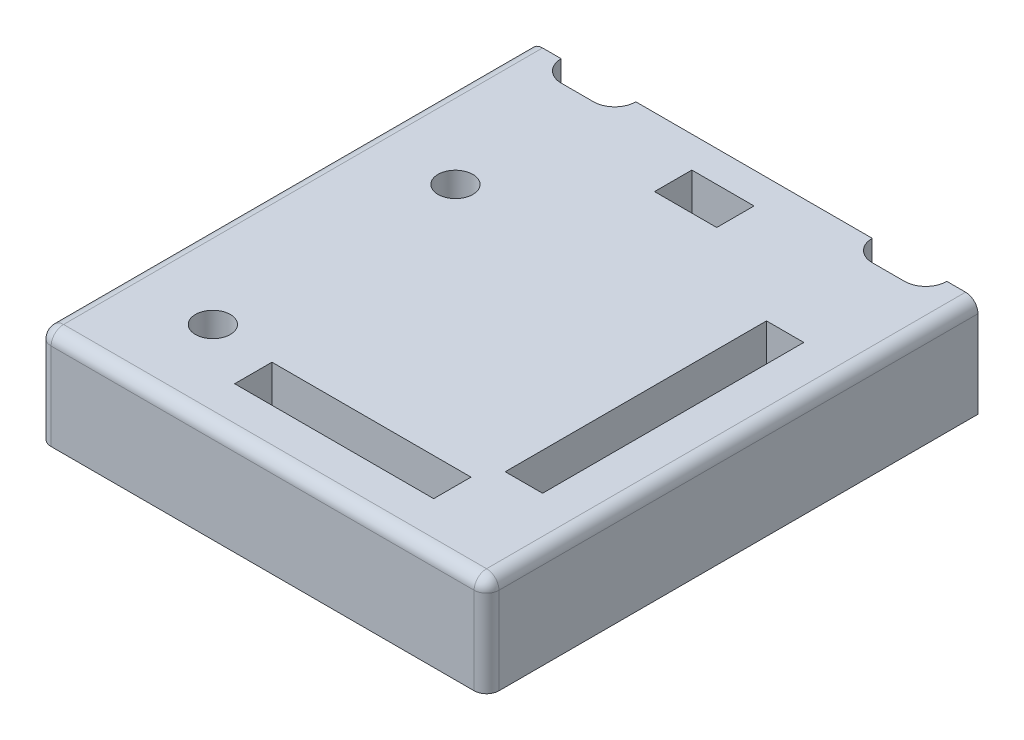
from build123d import *

# Parameters (mm, degrees)
SKETCH1_W                         = 36
SKETCH1_H                         = 33.5
SKETCH1_R                         = 1.4
SKETCH1_W_2                       = 3
SKETCH1_H_2                       = 21
SKETCH1_W_3                       = 16
SKETCH1_H_3                       = 3
BASE_DEPTH                        = 8
SKETCH3_W                         = 31
SKETCH3_H                         = 28.5
INTERIOR_CUTOUT_DEPTH             = 5
BASKET_MOUNTING_EDGE_DEPTH        = 8
SKETCH6_R                         = 1.4
BASKET_MOUNTING_SCREW_HOLES_DEPTH = 7
SKETCH7_W                         = 5
SKETCH7_H                         = 3
ZIP_TIE_HOLE_DEPTH                = 31.092565527
F_1MM_EDGE_FILLETS_R              = 1


with BuildPart() as part:
    # Sketch1 → Base (new body)
    with BuildSketch(Plane(origin=(0, 0, 0), x_dir=(1, 0, 0), z_dir=(0, 1, 0))):
        Rectangle(SKETCH1_W, SKETCH1_H)
        with Locations(Location((-11, -9.75, 0), (0, 0, 270))):
            Circle(SKETCH1_R, mode=Mode.SUBTRACT)
        with Locations(Location((-11, 9.75, 0), (0, 0, 270))):
            Circle(SKETCH1_R, mode=Mode.SUBTRACT)
        with Locations((12.5, 2.25)):
            Rectangle(SKETCH1_W_2, SKETCH1_H_2, mode=Mode.SUBTRACT)
        with Locations((2, -11.5)):
            Rectangle(SKETCH1_W_3, SKETCH1_H_3, mode=Mode.SUBTRACT)
    extrude(amount=BASE_DEPTH)

    # Sketch3 → Interior Cutout (cut)
    with BuildSketch(Plane.XZ):
        Rectangle(SKETCH3_W, SKETCH3_H)
    extrude(amount=-INTERIOR_CUTOUT_DEPTH, mode=Mode.SUBTRACT)

    # Sketch5 → Basket Mounting Edge (add)
    with BuildSketch(Plane(origin=(0, 0, 0), x_dir=(1, 0, 0), z_dir=(0, 1, 0))):
        with BuildLine():
            Line((-18, 16.75), (18, 16.75))
            Line((18, 16.75), (18, 22.75))
            Line((18, 22.75), (15.5, 22.75))
            ThreePointArc((15.5, 22.75), (15.002081528, 21.547918472), (13.8, 21.05))
            Line((13.8, 21.05), (11.2, 21.05))
            ThreePointArc((11.2, 21.05), (9.997918472, 21.547918472), (9.5, 22.75))
            Line((9.5, 22.75), (-9.5, 22.75))
            ThreePointArc((-9.5, 22.75), (-9.997918472, 21.547918472), (-11.2, 21.05))
            Line((-11.2, 21.05), (-13.8, 21.05))
            ThreePointArc((-13.8, 21.05), (-15.002081528, 21.547918472), (-15.5, 22.75))
            Line((-15.5, 22.75), (-18, 22.75))
            Line((-18, 22.75), (-18, 16.75))
        make_face()
    extrude(amount=BASKET_MOUNTING_EDGE_DEPTH)

    # Sketch6 → Basket Mounting Screw Holes (cut)
    with BuildSketch(Plane(origin=(0, 0, -22.75), x_dir=(-1, 0, 0), z_dir=(0, 0, -1))):
        with Locations((-5, 4)):
            Circle(SKETCH6_R)
        with Locations(Location((5, 4, 0), (0, 0, 180))):
            Circle(SKETCH6_R)
    extrude(amount=-BASKET_MOUNTING_SCREW_HOLES_DEPTH, mode=Mode.SUBTRACT)

    # Sketch7 → Zip Tie Hole (cut, through all)
    with BuildSketch(Plane(origin=(0, 8, 0), x_dir=(1, 0, 0), z_dir=(0, 1, 0))):
        with Locations((0, 18.75)):
            Rectangle(SKETCH7_W, SKETCH7_H)
    extrude(amount=-ZIP_TIE_HOLE_DEPTH, mode=Mode.SUBTRACT)

    # 1mm Edge Fillets
    f_1mm_edge_fillets_edges = [part.edges().sort_by_distance(p)[0] for p in [
        (18, 8, -3),
        (-18, 8, -3),
        (18, 4, 16.75),
        (-18, 4, 16.75),
        (0, 8, 16.75),
    ]]
    fillet(f_1mm_edge_fillets_edges, radius=F_1MM_EDGE_FILLETS_R)


solid = part.part
